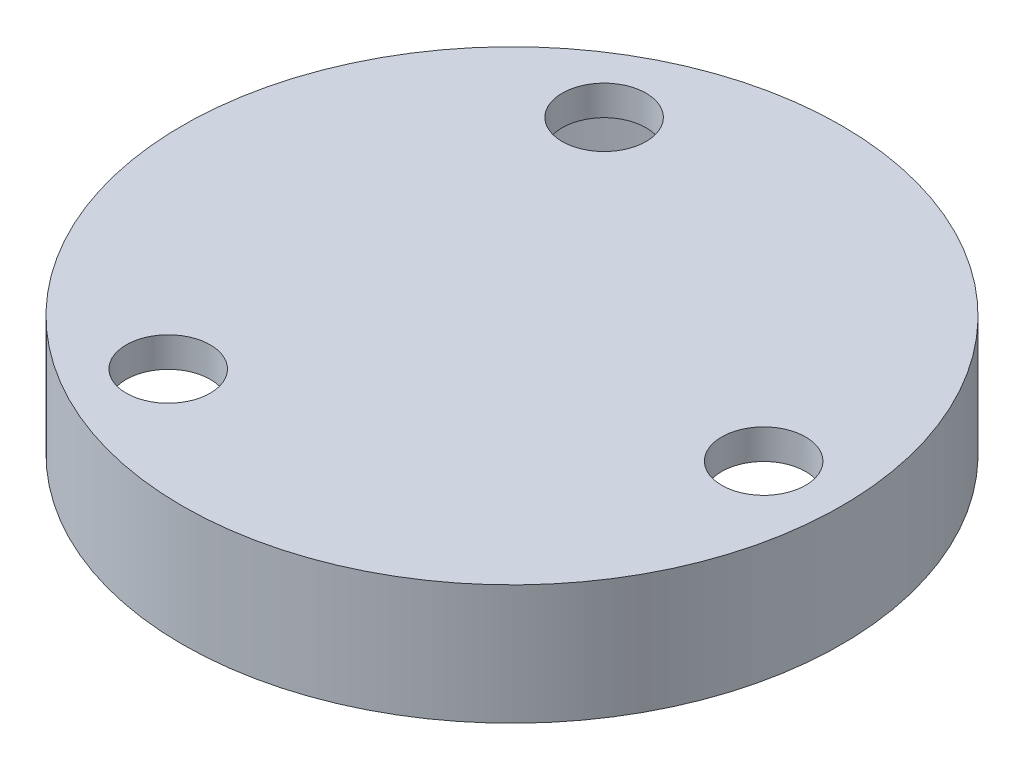
from build123d import *

# Parameters (mm, degrees)
SKETCH1_R             = 55
BOSS_EXTRUDE1_DEPTH   = 20
SKETCH2_R             = 50
CUT_EXTRUDE1_DEPTH    = 15
F_1_0MM_DOWEL_HOLE1_D = 14


with BuildPart() as part:
    # Sketch1 → Boss-Extrude1 (new body)
    with BuildSketch(Plane(origin=(0, 0, 0), x_dir=(1, 0, 0), z_dir=(0, 1, 0))):
        with Locations(Location((0, 0, 0), (0, 0, 270))):
            Circle(SKETCH1_R)
    extrude(amount=BOSS_EXTRUDE1_DEPTH)

    # Sketch2 → Cut-Extrude1 (cut)
    with BuildSketch(Plane.XZ):
        with Locations(Location((0, 0, 0), (0, 0, 270))):
            Circle(SKETCH2_R)
    extrude(amount=-CUT_EXTRUDE1_DEPTH, mode=Mode.SUBTRACT)

    # Ø1.0mm Dowel Hole1 (through all)
    with Locations(Plane(origin=(0, 20, 0), x_dir=(1, 0, 0), z_dir=(0, 1, 0))):
        with Locations((42, 0), (-21, 36.373066959), (-21, -36.373066959)):
            Hole(F_1_0MM_DOWEL_HOLE1_D / 2)


solid = part.part
